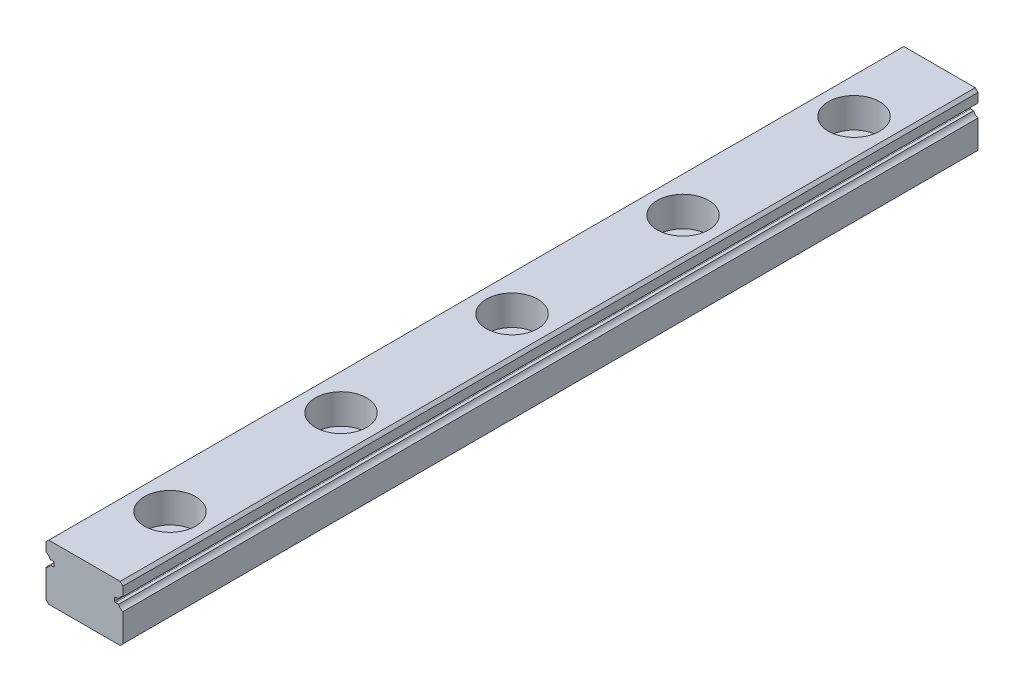
from build123d import *

# Parameters (mm, degrees)
EXTRUDE_1_DEPTH              = 100
HOLE_WIZARD_M2_1_D           = 2.4
HOLE_WIZARD_M2_1_CBORE_D     = 6
HOLE_WIZARD_M2_1_CBORE_DEPTH = 3.5
PATTERN_LINEAR_1_COUNT       = 5
PATTERN_LINEAR_1_PITCH       = 20


with BuildPart() as part:
    # 草图1 → 凸台-拉伸1 (new body)
    with BuildSketch(Plane.XY):
        with BuildLine():
            Line((-4.5, -2.905269119), (-4.5, -6.175269119))
            Line((-4.5, -6.175269119), (-4.174730881, -6.500538239))
            Line((-4.174730881, -6.500538239), (0, -6.500538239))
            Line((0, -6.500538239), (4.174730881, -6.500538239))
            Line((4.174730881, -6.500538239), (4.5, -6.175269119))
            Line((4.5, -6.175269119), (4.5, -2.905269119))
            ThreePointArc((4.5, -2.905269119), (4.188070601, -2.722678698), (3.990111871, -2.420269119))
            Line((3.990111871, -2.420269119), (3.630111871, -2.420269119))
            ThreePointArc((3.630111871, -2.420269119), (3.566472261, -2.39390873), (3.540111871, -2.330269119))
            Line((3.540111871, -2.330269119), (3.540111871, -1.970269119))
            ThreePointArc((3.540111871, -1.970269119), (3.566472261, -1.906629509), (3.630111871, -1.880269119))
            Line((3.630111871, -1.880269119), (3.990111871, -1.880269119))
            ThreePointArc((3.990111871, -1.880269119), (4.188070601, -1.577859541), (4.5, -1.395269119))
            Line((4.5, -1.395269119), (4.5, -0.325269119))
            Line((4.5, -0.325269119), (4.174730881, 0))
            Line((4.174730881, 0), (0, 0))
            Line((0, 0), (-4.174730881, 0))
            Line((-4.174730881, 0), (-4.5, -0.325269119))
            Line((-4.5, -0.325269119), (-4.5, -1.395269119))
            ThreePointArc((-4.5, -1.395269119), (-4.188070601, -1.577859541), (-3.990111871, -1.880269119))
            Line((-3.990111871, -1.880269119), (-3.630111871, -1.880269119))
            ThreePointArc((-3.630111871, -1.880269119), (-3.566472261, -1.906629509), (-3.540111871, -1.970269119))
            Line((-3.540111871, -1.970269119), (-3.540111871, -2.330269119))
            ThreePointArc((-3.540111871, -2.330269119), (-3.566472261, -2.39390873), (-3.630111871, -2.420269119))
            Line((-3.630111871, -2.420269119), (-3.990111871, -2.420269119))
            ThreePointArc((-3.990111871, -2.420269119), (-4.188070601, -2.722678698), (-4.5, -2.905269119))
        make_face()
    extrude(amount=EXTRUDE_1_DEPTH)

    # M2 六角头螺栓的柱形沉头孔1 (through all)
    with Locations(Plane(origin=(0, 0, 0), x_dir=(1, 0, 0), z_dir=(0, 1, 0))):
        with Locations((0, -90)):
            hole_wizard_m2_1 = CounterBoreHole(HOLE_WIZARD_M2_1_D / 2, HOLE_WIZARD_M2_1_CBORE_D / 2, HOLE_WIZARD_M2_1_CBORE_DEPTH)

    # 阵列(线性)1: M2 六角头螺栓的柱形沉头孔1 ×5
    with Locations(*[(0, 0, -i * PATTERN_LINEAR_1_PITCH) for i in range(1, PATTERN_LINEAR_1_COUNT)]):
        add(hole_wizard_m2_1, mode=Mode.SUBTRACT)


solid = part.part
